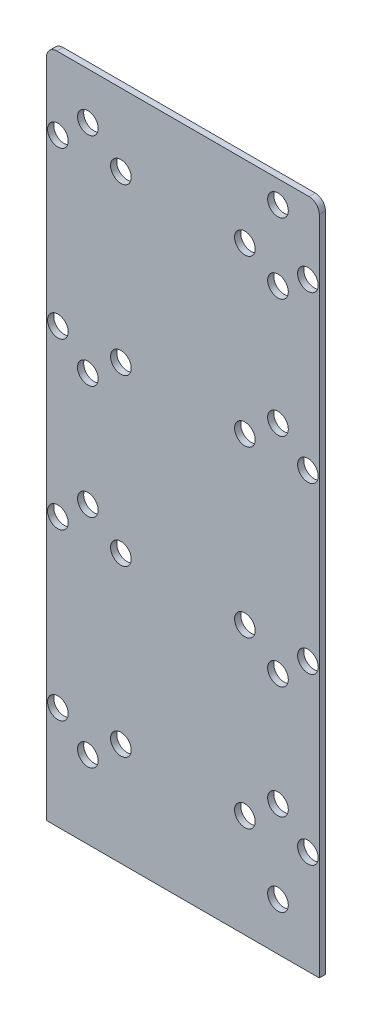
from build123d import *

# Parameters (mm, degrees)
SKETCH1_W           = 132
SKETCH1_H           = 325
BOSS_EXTRUDE1_DEPTH = 3
SKETCH2_R           = 5
CUT_EXTRUDE1_DEPTH  = 537.159285925
SKETCH3_R           = 5
CUT_EXTRUDE2_DEPTH  = 10
SKETCH4_R           = 5
CUT_EXTRUDE3_DEPTH  = 10
LPATTERN1_COUNT     = 4
LPATTERN1_PITCH     = 80
FILLET1_R           = 5


with BuildPart() as part:
    # Sketch1 → Boss-Extrude1 (new body)
    with BuildSketch(Plane.XY.offset(3)):
        with Locations((24.851179955, 365.89742901)):
            Rectangle(SKETCH1_W, SKETCH1_H)
    extrude(amount=-BOSS_EXTRUDE1_DEPTH)

    # Sketch2 → Cut-Extrude1 (cut, through all)
    with BuildSketch(Plane.XY.offset(3)):
        with Locations((70.851179955, 517.39742901)):
            Circle(SKETCH2_R)
        with Locations((70.851179955, 483.39742901)):
            Circle(SKETCH2_R)
        with Locations((70.851179955, 425.89742901)):
            Circle(SKETCH2_R)
        with Locations((70.851179955, 320.89742901)):
            Circle(SKETCH2_R)
        with Locations((70.851179955, 266.39742901)):
            Circle(SKETCH2_R)
        with Locations((70.851179955, 226.39742901)):
            Circle(SKETCH2_R)
    extrude(amount=-CUT_EXTRUDE1_DEPTH, mode=Mode.SUBTRACT)

    # Sketch3 → Cut-Extrude2 (cut)
    with BuildSketch(Plane.XY.offset(3)):
        with Locations((-21.148820045, 505.89742901)):
            Circle(SKETCH3_R)
        with Locations((-21.148820045, 400.89742901)):
            Circle(SKETCH3_R)
        with Locations((-21.148820045, 345.89742901)):
            Circle(SKETCH3_R)
        with Locations((-21.148820045, 240.89742901)):
            Circle(SKETCH3_R)
    extrude(amount=-CUT_EXTRUDE2_DEPTH, mode=Mode.SUBTRACT)

    # Sketch4 → Cut-Extrude3 (cut)
    with BuildSketch(Plane.XY.offset(3)):
        with Locations((-35.648820045, 253.39742901)):
            Circle(SKETCH4_R)
        with Locations((-5.148820045, 253.39742901)):
            Circle(SKETCH4_R)
        with Locations((54.851179955, 253.39742901)):
            Circle(SKETCH4_R)
        with Locations((85.351179955, 253.39742901)):
            Circle(SKETCH4_R)
    cut_extrude3 = extrude(amount=-CUT_EXTRUDE3_DEPTH, mode=Mode.SUBTRACT)

    # LPattern1: Cut-Extrude3 ×4
    with Locations(*[(0, i * LPATTERN1_PITCH, 0) for i in range(1, LPATTERN1_COUNT)]):
        add(cut_extrude3, mode=Mode.SUBTRACT)

    # Fillet1
    fillet1_edges = [part.edges().sort_by_distance(p)[0] for p in [
        (-41.148820045, 528.39742901, 1.5),
        (90.851179955, 528.39742901, 1.5),
    ]]
    fillet(fillet1_edges, radius=FILLET1_R)


solid = part.part
